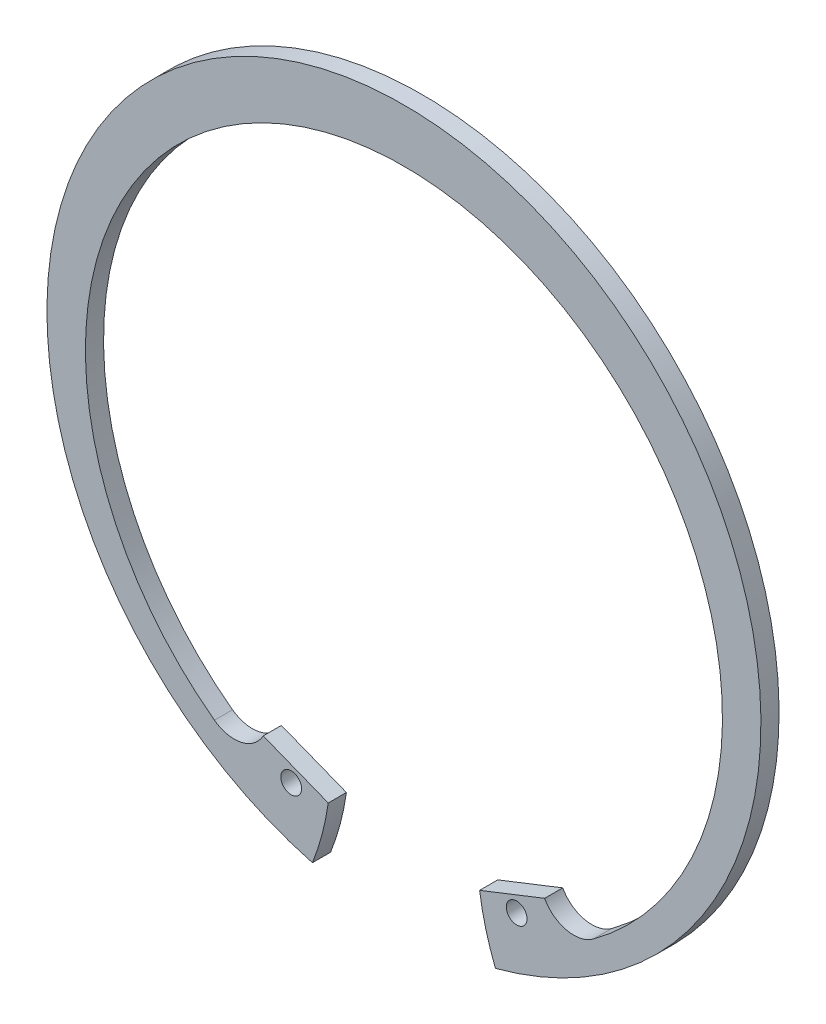
from build123d import *

# Parameters (mm, degrees)
BOSS_EXTRUDE1_DEPTH      = 1.3843
BOSS_EXTRUDE1_DEPTH_BACK = 1.3843
SKETCH3_R                = 1.5875
CUT_EXTRUDE1_DEPTH       = 78.080989378


with BuildPart() as part:
    # Sketch3 → Boss-Extrude1 (new, two sides: drawn at the far end of the back side and taken through both)
    with BuildSketch(Plane.XY.offset(-BOSS_EXTRUDE1_DEPTH_BACK)):
        with BuildLine():
            Line((-13.67380138, -52.752331459), (-11.3157, -43.654982291))
            Line((-11.3157, -43.654982291), (-21.476062034, -39.655785263))
            ThreePointArc((-21.476062034, -39.655785263), (-24.823734092, -42.182520656), (-28.926434765, -41.311230152))
            ThreePointArc((-28.926434765, -41.311230152), (0, 46.3931), (28.926434765, -41.311230152))
            ThreePointArc((28.926434765, -41.311230152), (24.823734092, -42.182520656), (21.476062034, -39.655785263))
            Line((21.476062034, -39.655785263), (11.3157, -43.654982291))
            Line((11.3157, -43.654982291), (13.67380138, -52.752331459))
            ThreePointArc((13.67380138, -52.752331459), (0, 54.4957), (-13.67380138, -52.752331459))
        make_face()
        with Locations((-17.210160294, -43.724142128)):
            Circle(SKETCH3_R, mode=Mode.SUBTRACT)
        with Locations(Location((17.210160294, -43.724142128, 0), (0, 0, 180))):
            Circle(SKETCH3_R, mode=Mode.SUBTRACT)
    extrude(amount=BOSS_EXTRUDE1_DEPTH + BOSS_EXTRUDE1_DEPTH_BACK)

    # Sketch4 → Cut-Extrude1 (cut, symmetric)
    with BuildSketch(Plane.XY):
        with BuildLine():
            Line((-13.968711324, -52.675007569), (-13.968711324, -66.643718893))
            Line((-13.968711324, -66.643718893), (0, -66.643718893))
            Line((0, -66.643718893), (0, -54.4957))
            Line((0, -54.4957), (0, -43.561952925))
            Line((0, -43.561952925), (-11.552050454, -43.561952925))
            ThreePointArc((-11.552050454, -43.561952925), (-12.491783859, -48.189708607), (-13.968711324, -52.675007569))
        make_face()
    cut_extrude1 = extrude(amount=CUT_EXTRUDE1_DEPTH, both=True, mode=Mode.SUBTRACT)

    # Mirror1: Cut-Extrude1 across plane
    add(cut_extrude1.mirror(Plane(origin=(0, 0, 0), x_dir=(0, 0, 1), z_dir=(1, 0, 0))), mode=Mode.SUBTRACT)


solid = part.part
